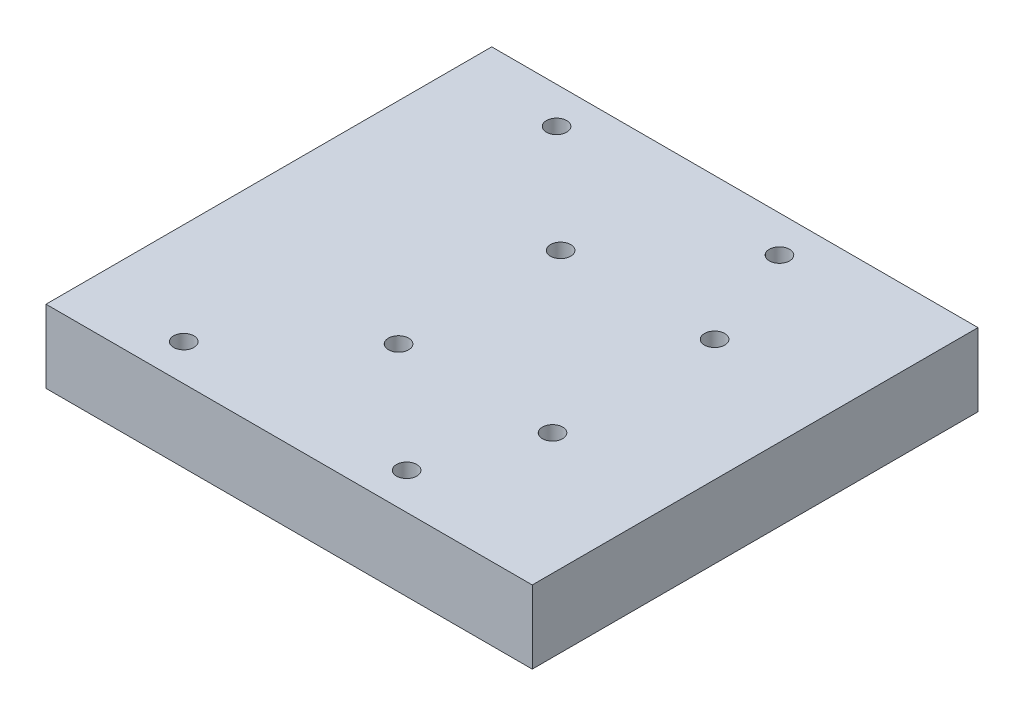
from build123d import *

# Parameters (mm, degrees)
SKETCH1_W                = 120
SKETCH1_H                = 110
BOSS_EXTRUDE1_DEPTH      = 18
F_5_0_5_DIAMETER_HOLE1_D = 5
F_5_0_5_DIAMETER_HOLE3_D = 5


with BuildPart() as part:
    # Sketch1 → Boss-Extrude1 (new body)
    with BuildSketch(Plane(origin=(0, 0, 0), x_dir=(1, 0, 0), z_dir=(0, 1, 0))):
        Rectangle(SKETCH1_W, SKETCH1_H)
    extrude(amount=BOSS_EXTRUDE1_DEPTH)

    # Ø5.0 (5) Diameter Hole1 (through all)
    with Locations(Plane(origin=(0, 0, 0), x_dir=(-1, 0, 0), z_dir=(0, -1, 0))):
        with Locations((-20, 46), (35, 46), (35, -46), (-20, -46)):
            Hole(F_5_0_5_DIAMETER_HOLE1_D / 2)

    # Ø5.0 (5) Diameter Hole3 (through all)
    with Locations(Plane(origin=(0, 0, 0), x_dir=(-1, 0, 0), z_dir=(0, -1, 0))):
        with Locations((8, 20), (-30, 20), (-30, -20), (8, -20)):
            Hole(F_5_0_5_DIAMETER_HOLE3_D / 2)


solid = part.part
